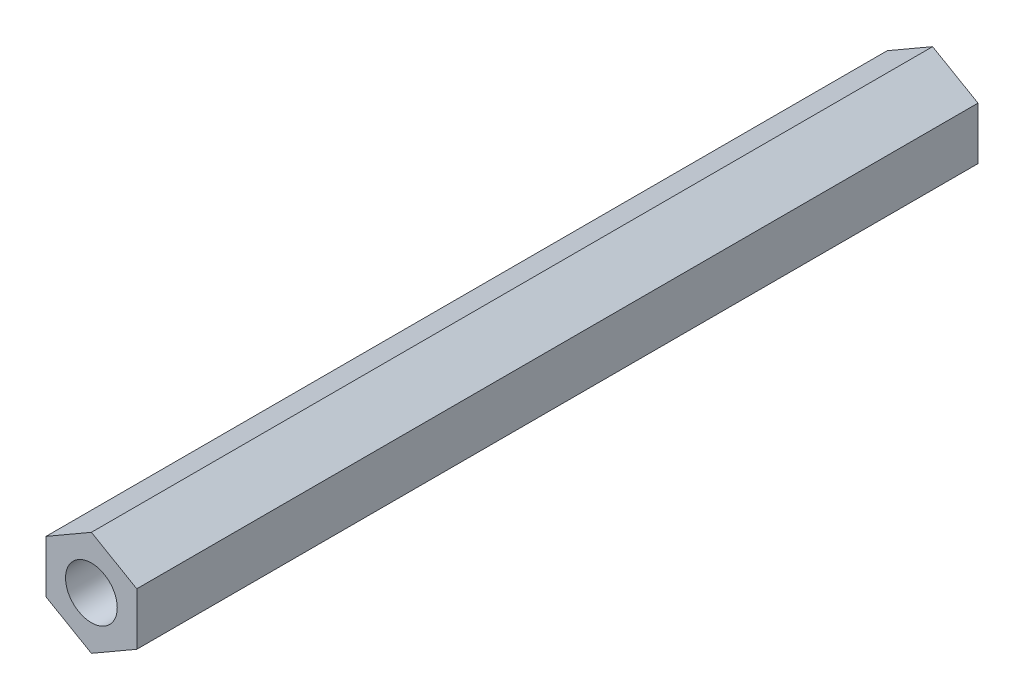
from build123d import *

# Parameters (mm, degrees)
SKETCH_1_R      = 2
EXTRUDE_1_DEPTH = 65


with BuildPart() as part:
    # 草图1 → 凸台-拉伸1 (new body)
    with BuildSketch(Plane.XY):
        Polygon((0, 4.05), (-3.507402885, 2.025), (-3.507402885, -2.025), (0, -4.05), (3.507402885, -2.025), (3.507402885, 2.025), align=None)
        Circle(SKETCH_1_R, mode=Mode.SUBTRACT)
    extrude(amount=EXTRUDE_1_DEPTH)


solid = part.part
